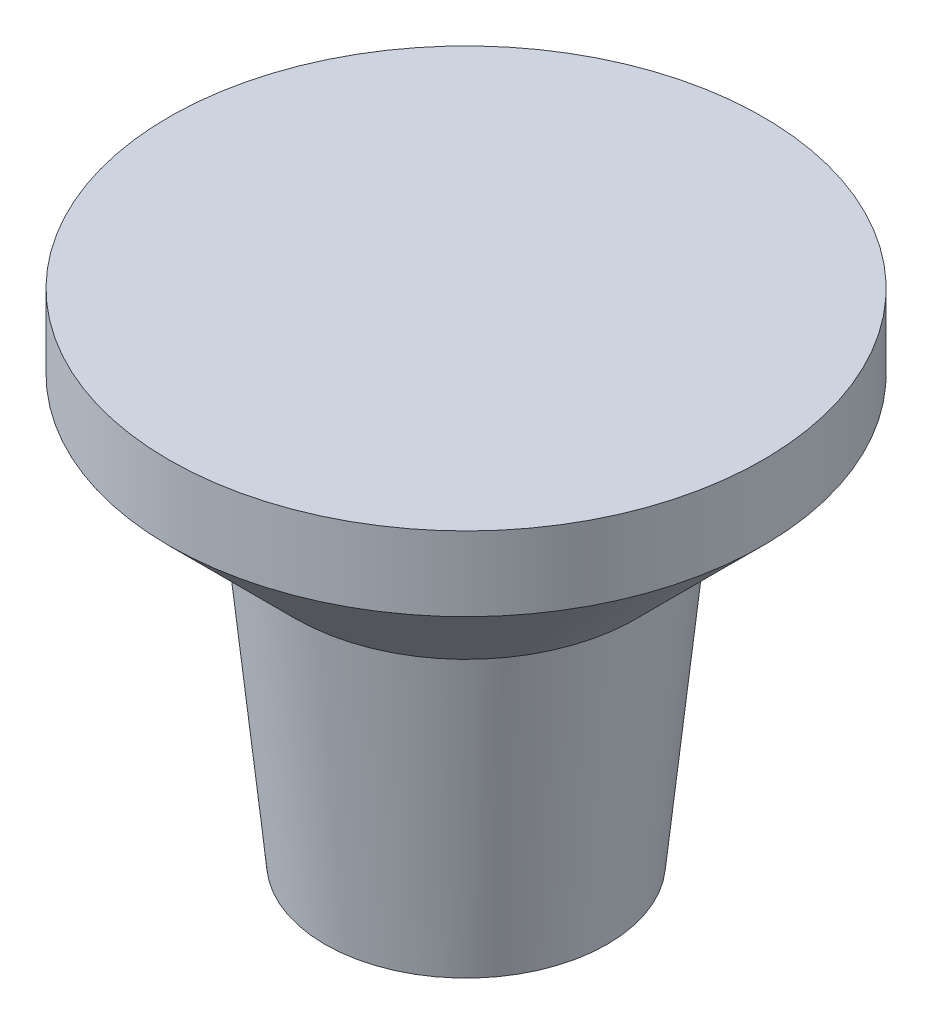
from build123d import *


with BuildPart() as part:
    # Sketch1 → Revolve1 (revolve)
    with BuildSketch(Plane.XY, mode=Mode.PRIVATE) as revolve1_sk:
        Polygon((0, 0), (3.8, 0), (4.6, 8), (8, 11.4), (8, 13.4), (0, 13.4), align=None)
    revolve(revolve1_sk.sketch.rotate(Axis((0, 55, 0), (0, -1, 0)), 90), axis=Axis((0, 55, 0), (0, -1, 0)))


solid = part.part
